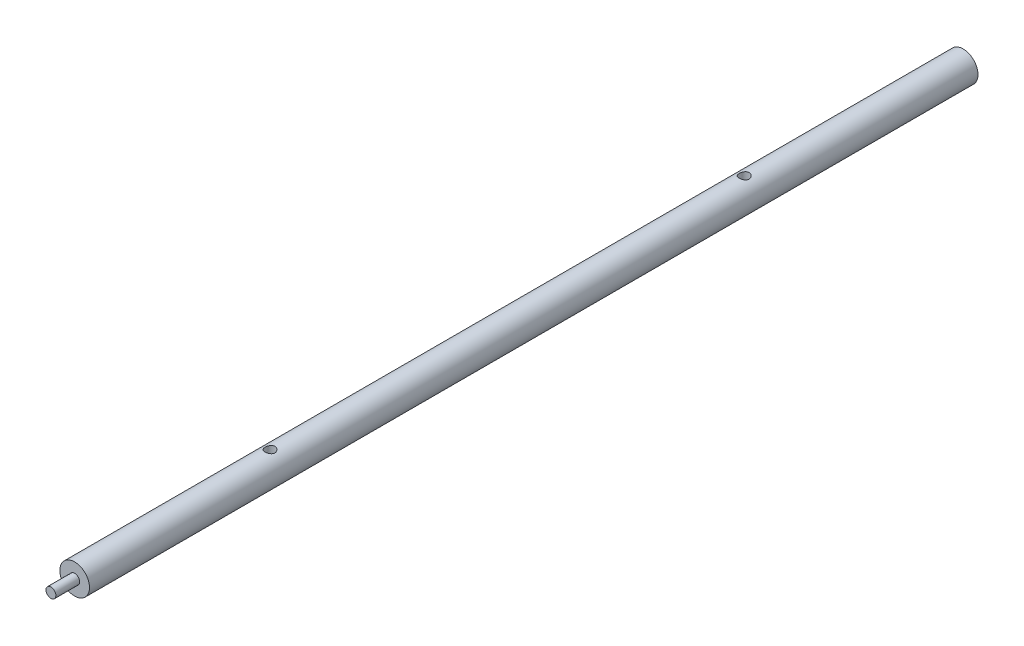
from build123d import *

# Parameters (mm, degrees)
SKETCH1_R           = 9.525
BOSS_EXTRUDE1_DEPTH = 586.105
CUT_EXTRUDE2_REACH  = 588.492
SKETCH3_R           = 3.175
CUT_EXTRUDE3_DEPTH  = 2.38125
SKETCH6_OUTSIDE_W   = 138.394
SKETCH6_OUTSIDE_H   = 138.394
SKETCH6_OUTSIDE_R   = 3.175
CUT_EXTRUDE4_DEPTH  = 15.24


with BuildPart() as part:
    # Sketch1 → Boss-Extrude1 (new body)
    with BuildSketch(Plane.XY):
        Circle(SKETCH1_R)
    extrude(amount=BOSS_EXTRUDE1_DEPTH)

    # Sketch3 → Cut-Extrude2 (cut, up to next)
    with BuildSketch(Plane(origin=(0, -9.525, 0), x_dir=(1, 0, 0), z_dir=(0, 1, 0)), mode=Mode.PRIVATE) as cut_extrude2_sk1:
        with Locations((0, -445.389)):
            Circle(SKETCH3_R)
    cut_extrude2_tool1 = extrude(cut_extrude2_sk1.sketch, amount=CUT_EXTRUDE2_REACH, mode=Mode.PRIVATE) & part.part
    # Sketch3 → Cut-Extrude2 (cut, up to next)
    with BuildSketch(Plane(origin=(0, -9.525, 0), x_dir=(1, 0, 0), z_dir=(0, 1, 0)), mode=Mode.PRIVATE) as cut_extrude2_sk2:
        with Locations((0, -140.716)):
            Circle(SKETCH3_R)
    cut_extrude2_tool2 = extrude(cut_extrude2_sk2.sketch, amount=CUT_EXTRUDE2_REACH, mode=Mode.PRIVATE) & part.part
    add(cut_extrude2_tool1.solids().sort_by_distance((0, -9.525, 445.389))[0], mode=Mode.SUBTRACT)
    add(cut_extrude2_tool2.solids().sort_by_distance((0, -9.525, 140.716))[0], mode=Mode.SUBTRACT)

    # Sketch5 → Cut-Extrude3 (cut)
    with BuildSketch(Plane(origin=(0, -9.525, 0), x_dir=(1, 0, 0), z_dir=(0, 1, 0))):
        with BuildLine():
            Line((-2.38125, -178.816), (-2.38125, -159.766))
            ThreePointArc((-2.38125, -159.766), (0, -157.38475), (2.38125, -159.766))
            Line((2.38125, -159.766), (2.38125, -178.816))
            ThreePointArc((2.38125, -178.816), (0, -181.19725), (-2.38125, -178.816))
        make_face()
        with BuildLine():
            Line((2.38125, -407.289), (2.38125, -426.339))
            ThreePointArc((2.38125, -426.339), (0, -428.72025), (-2.38125, -426.339))
            Line((-2.38125, -426.339), (-2.38125, -407.289))
            ThreePointArc((-2.38125, -407.289), (0, -404.90775), (2.38125, -407.289))
        make_face()
    extrude(amount=CUT_EXTRUDE3_DEPTH, mode=Mode.SUBTRACT)

    # Sketch6 outside → Cut-Extrude4 (cut)
    with BuildSketch(Plane.XY.offset(586.105)):
        Rectangle(SKETCH6_OUTSIDE_W, SKETCH6_OUTSIDE_H)
        Circle(SKETCH6_OUTSIDE_R, mode=Mode.SUBTRACT)
    extrude(amount=-CUT_EXTRUDE4_DEPTH, mode=Mode.SUBTRACT)


solid = part.part
